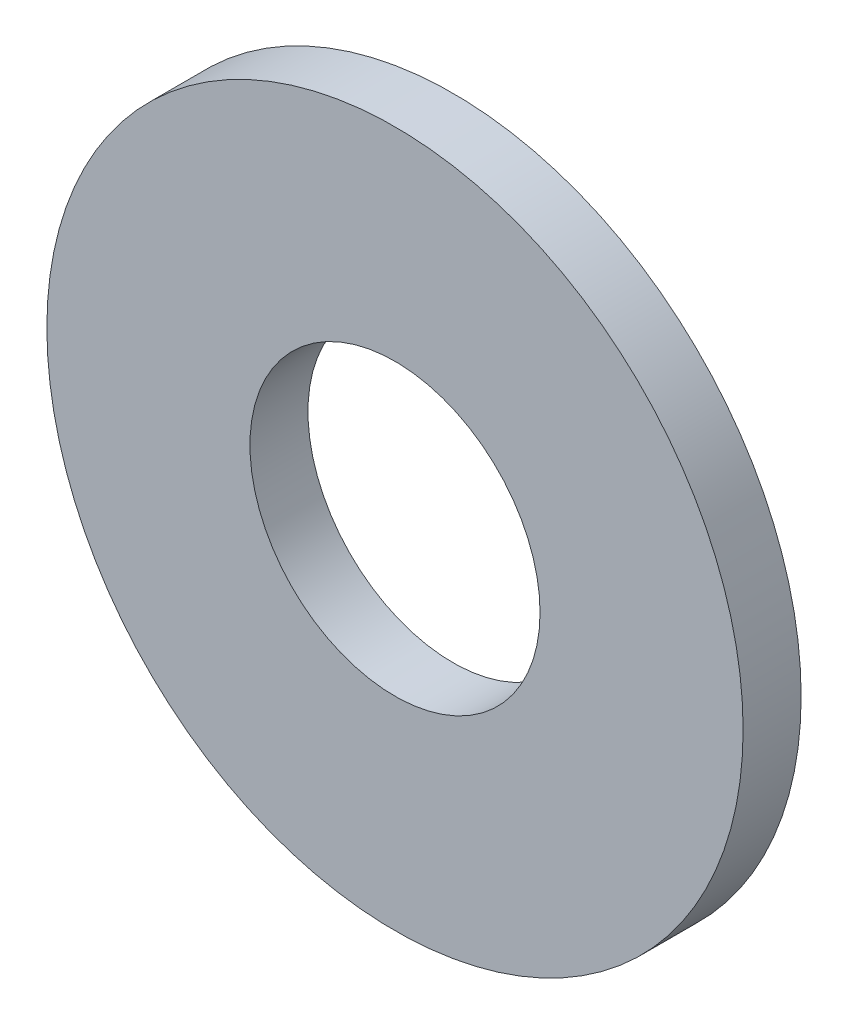
from build123d import *

# Parameters (mm, degrees)
SKETCH_1_R      = 12
SKETCH_1_R_2    = 5
EXTRUDE_1_DEPTH = 2


with BuildPart() as part:
    # Эскиз1 → Вытянуть1 (new body)
    with BuildSketch(Plane.XY):
        Circle(SKETCH_1_R)
        Circle(SKETCH_1_R_2, mode=Mode.SUBTRACT)
    extrude(amount=EXTRUDE_1_DEPTH)


solid = part.part
